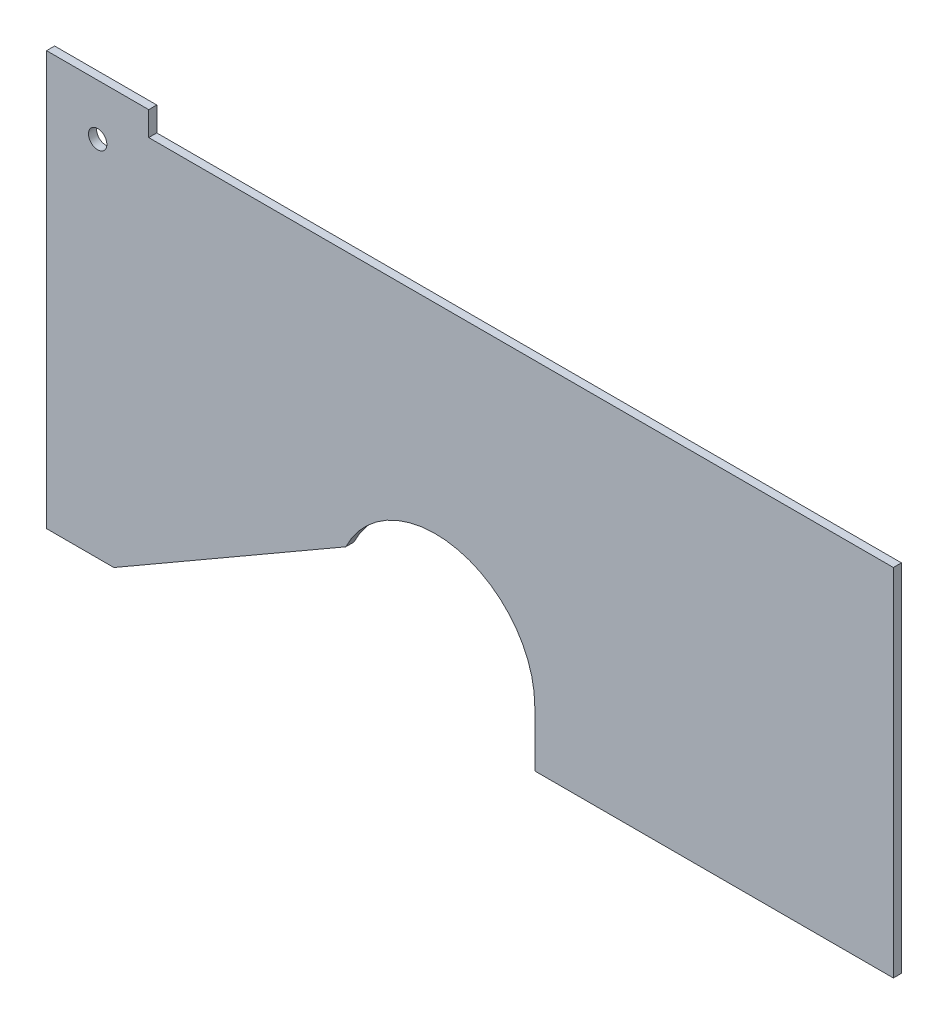
from build123d import *

# Parameters (mm, degrees)
SKETCH2_R           = 3.425
BOSS_EXTRUDE2_DEPTH = 3
SKETCH3_W           = 133.4
SKETCH3_H           = 12.75
CUT_EXTRUDE1_DEPTH  = 351.642267846


with BuildPart() as part:
    # Sketch2 → Boss-Extrude2 (new body)
    with BuildSketch(Plane.XY):
        with BuildLine():
            Line((25.03035901, 0), (111.286489227, 49.8))
            ThreePointArc((111.286489227, 49.8), (152.858332199, 69.766604349), (181.6, 33.7))
            Line((181.6, 33.7), (181.6, 0))
            Line((181.6, 0), (315, 0))
            Line((315, 0), (315, 145))
            Line((315, 145), (38, 145))
            Line((38, 145), (38, 154))
            Line((38, 154), (19, 154))
            Line((19, 154), (0, 154))
            Line((0, 154), (0, 0))
            Line((0, 0), (25.03035901, 0))
        make_face()
        with Locations((19, 135)):
            Circle(SKETCH2_R, mode=Mode.SUBTRACT)
    extrude(amount=BOSS_EXTRUDE2_DEPTH)

    # Sketch3 → Cut-Extrude1 (cut, through all)
    with BuildSketch(Plane.XY.offset(3)):
        with Locations((248.3, 6.375)):
            Rectangle(SKETCH3_W, SKETCH3_H)
    extrude(amount=-CUT_EXTRUDE1_DEPTH, mode=Mode.SUBTRACT)


solid = part.part
